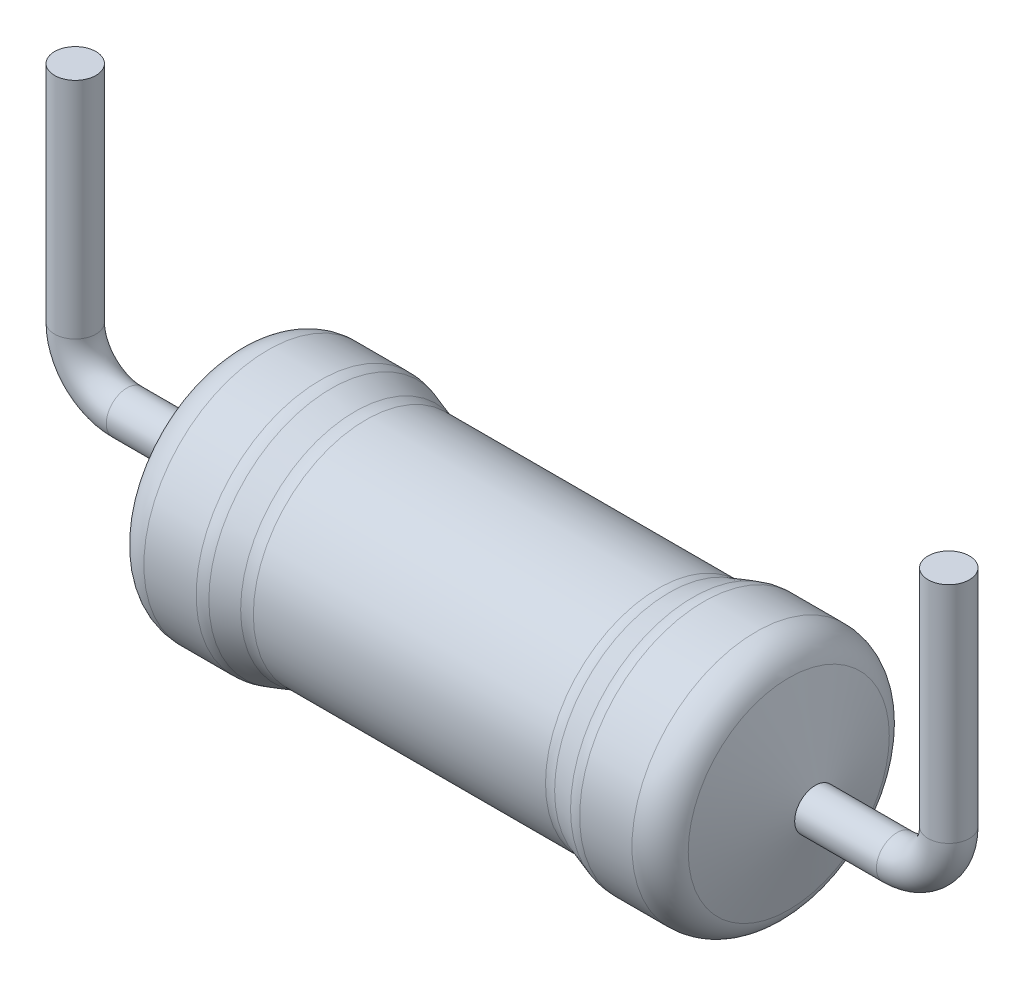
from build123d import *

# Parameters (mm, degrees)
FILLET1_R = 0.5
SKETCH4_R = 0.3


with BuildPart() as part:
    # Sketch1 → Revolve1 (revolve)
    with BuildSketch(Plane.XY, mode=Mode.PRIVATE) as revolve1_sk:
        Polygon((0, 0), (4.4, 0), (4.4, 0.3), (3.9, 1.8), (2.7, 1.8), (2.2, 1.633333333), (-2.2, 1.633333333), (-2.7, 1.8), (-3.9, 1.8), (-4.4, 0.3), (-4.4, 0), align=None)
    revolve(revolve1_sk.sketch.rotate(Axis((0, 0, 0), (1, 0, 0)), 90), axis=Axis((0, 0, 0), (1, 0, 0)))

    # Fillet1
    fillet1_edges = [part.edges().sort_by_distance(p)[0] for p in [
        (2.7, 0, -1.8),
        (3.9, 0, -1.8),
        (-3.9, 0, -1.8),
        (-2.7, 0, -1.8),
        (-2.2, 0, -1.633333333),
        (2.2, 0, -1.633333333),
    ]]
    fillet(fillet1_edges, radius=FILLET1_R)

    # Sweep1: sweep along a path in Sketch6
    with BuildLine(Plane.XY) as sweep1_path:
        Line((6.335, 4), (6.335, 0.75))
        ThreePointArc((6.335, 0.75), (6.115330086, 0.219669914), (5.585, 0))
        Line((5.585, 0), (4.4, 0))
        Line((4.4, 0), (-5.585, 0))
        ThreePointArc((-5.585, 0), (-6.115330086, 0.219669914), (-6.335, 0.75))
        Line((-6.335, 0.75), (-6.335, 4))
    # Sketch4 → Sweep1 (sweep)
    with BuildSketch(Plane(origin=(4.4, 0, 0), x_dir=(0, 0, -1), z_dir=(1, 0, 0))):
        Circle(SKETCH4_R)
    sweep(path=sweep1_path.line)


solid = part.part
